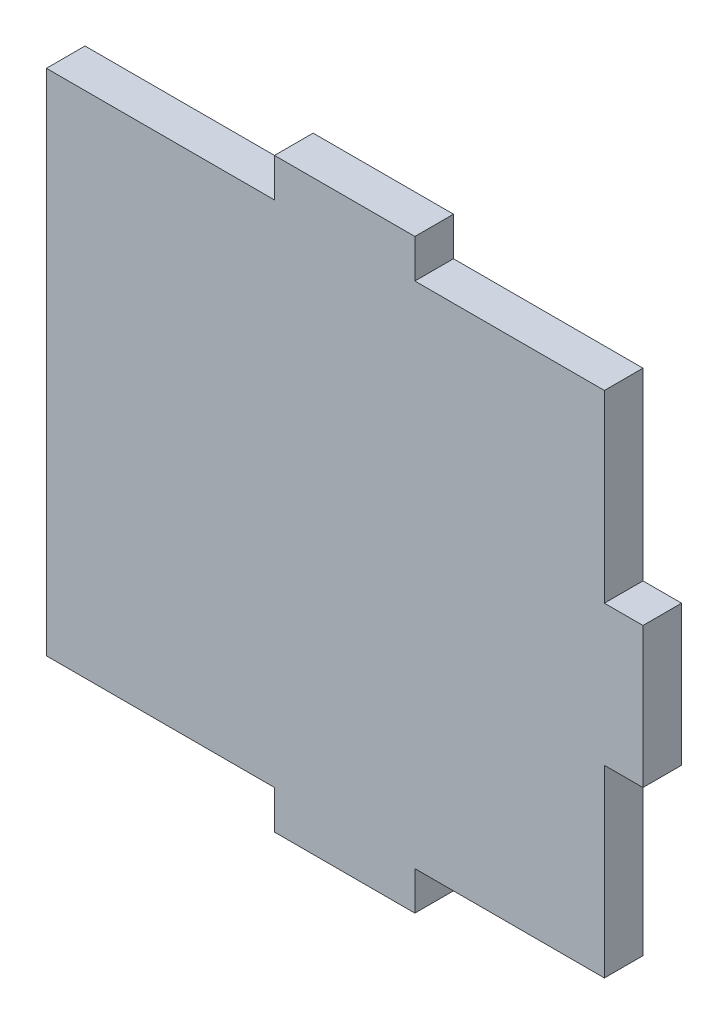
from build123d import *

# Parameters (mm, degrees)
SALIENTE_EXTRUIR1_DEPTH = 5.5


with BuildPart() as part:
    # Croquis1 → Saliente-Extruir1 (new body)
    with BuildSketch(Plane.XY):
        Polygon((-65.492187852, -11.885527809), (-32.992187852, -11.885527809), (-32.992187852, -17.385527809), (-22.992187852, -17.385527809), (-12.992187852, -17.385527809), (-12.992187852, -11.885527809), (14.007812148, -11.885527809), (14.007812148, 14.364472191), (19.507812148, 14.364472191), (19.507812148, 34.364472191), (14.007812148, 34.364472191), (14.007812148, 60.614472191), (-12.992187852, 60.614472191), (-12.992187852, 66.114472191), (-22.992187852, 66.114472191), (-32.992187852, 66.114472191), (-32.992187852, 60.614472191), (-65.492187852, 60.614472191), align=None)
    extrude(amount=SALIENTE_EXTRUIR1_DEPTH)


solid = part.part
